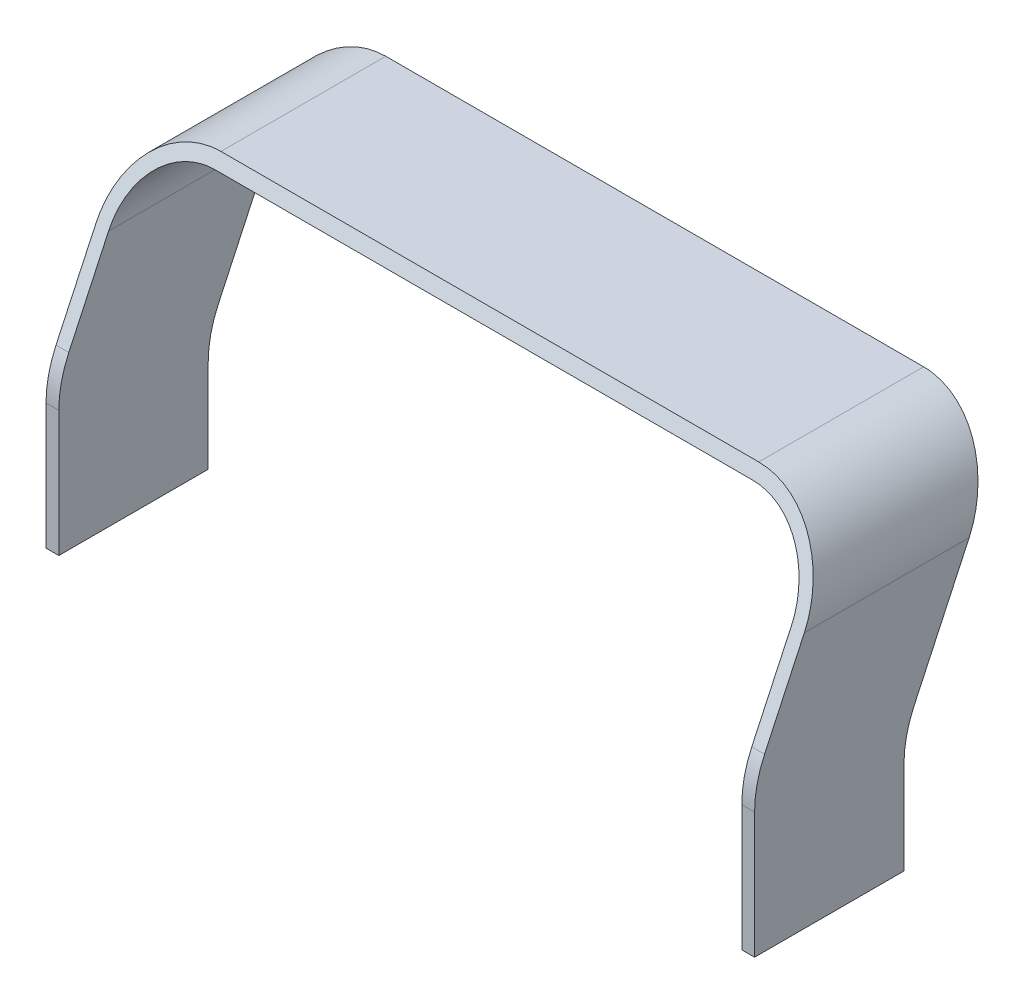
from build123d import *

# Parameters (mm, degrees)
BOSS_EXTRUDE1_DEPTH = 70
CUT_EXTRUDE1_DEPTH  = 200.200903612
FILLET1_R           = 25


with BuildPart() as part:
    # Sketch1 → Boss-Extrude1 (new body)
    with BuildSketch(Plane.XY):
        with BuildLine():
            Line((-83, 5), (-83, 65))
            ThreePointArc((-83, 65), (-77.142135624, 79.142135624), (-63, 85))
            Line((-63, 85), (63, 85))
            ThreePointArc((63, 85), (77.142135624, 79.142135624), (83, 65))
            Line((83, 65), (83, 5))
            Line((83, 5), (80, 5))
            Line((80, 5), (80, 65))
            ThreePointArc((80, 65), (75.02081528, 77.02081528), (63, 82))
            Line((63, 82), (-63, 82))
            ThreePointArc((-63, 82), (-75.02081528, 77.02081528), (-80, 65))
            Line((-80, 65), (-80, 5))
            Line((-80, 5), (-83, 5))
        make_face()
    extrude(amount=BOSS_EXTRUDE1_DEPTH)

    # Sketch2 → Cut-Extrude1 (cut, through all)
    with BuildSketch(Plane.ZY.offset(83)):
        Polygon((49.016155383, 85), (70, 40), (70, 85), align=None)
        Polygon((10.397928219, 85), (35, 32.240686807), (35, 4.870884332), (0, 4.870884332), (0, 85), align=None)
    extrude(amount=-CUT_EXTRUDE1_DEPTH, mode=Mode.SUBTRACT)

    # Fillet1
    fillet1_edges = [part.edges().sort_by_distance(p)[0] for p in [
        (-81.5, 40, 70),
        (81.5, 40, 70),
        (-81.5, 32.240686807, 35),
        (81.5, 32.240686807, 35),
    ]]
    fillet(fillet1_edges, radius=FILLET1_R)


solid = part.part
